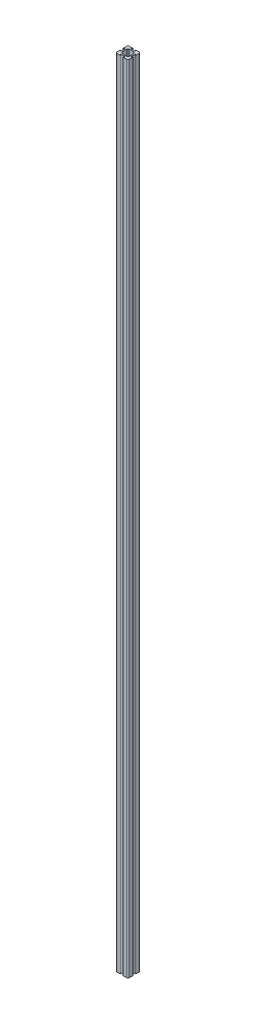
from build123d import *

# Parameters (mm, degrees)
BOSS_EXTRUDE1_DEPTH = 1600


with BuildPart() as part:
    # Sketch1 → Boss-Extrude1 (new body)
    with BuildSketch(Plane(origin=(0, 0, 0), x_dir=(1, 0, 0), z_dir=(0, 1, 0))):
        with BuildLine():
            Line((-9.5, 12.5), (-2.5, 12.5))
            Line((-2.5, 12.5), (-5, 10))
            Line((-5, 10), (5, 10))
            Line((5, 10), (2.5, 12.5))
            Line((2.5, 12.5), (9.5, 12.5))
            ThreePointArc((9.5, 12.5), (11.621320344, 11.621320344), (12.5, 9.5))
            Line((12.5, 9.5), (12.5, 2.5))
            Line((12.5, 2.5), (10, 5))
            Line((10, 5), (10, -5))
            Line((10, -5), (12.5, -2.5))
            Line((12.5, -2.5), (12.5, -9.5))
            ThreePointArc((12.5, -9.5), (11.621320344, -11.621320344), (9.5, -12.5))
            Line((9.5, -12.5), (2.5, -12.5))
            Line((2.5, -12.5), (5, -10))
            Line((5, -10), (-5, -10))
            Line((-5, -10), (-2.5, -12.5))
            Line((-2.5, -12.5), (-9.5, -12.5))
            ThreePointArc((-9.5, -12.5), (-11.621320344, -11.621320344), (-12.5, -9.5))
            Line((-12.5, -9.5), (-12.5, -2.5))
            Line((-12.5, -2.5), (-10, -5))
            Line((-10, -5), (-10, 5))
            Line((-10, 5), (-12.5, 2.5))
            Line((-12.5, 2.5), (-12.5, 9.5))
            ThreePointArc((-12.5, 9.5), (-11.621320344, 11.621320344), (-9.5, 12.5))
        make_face()
        Polygon((-7.5, 5), (-5, 7.5), (5, 7.5), (7.5, 5), (7.5, -5), (5, -7.5), (-5, -7.5), (-7.5, -5), align=None, mode=Mode.SUBTRACT)
    extrude(amount=BOSS_EXTRUDE1_DEPTH)


solid = part.part
